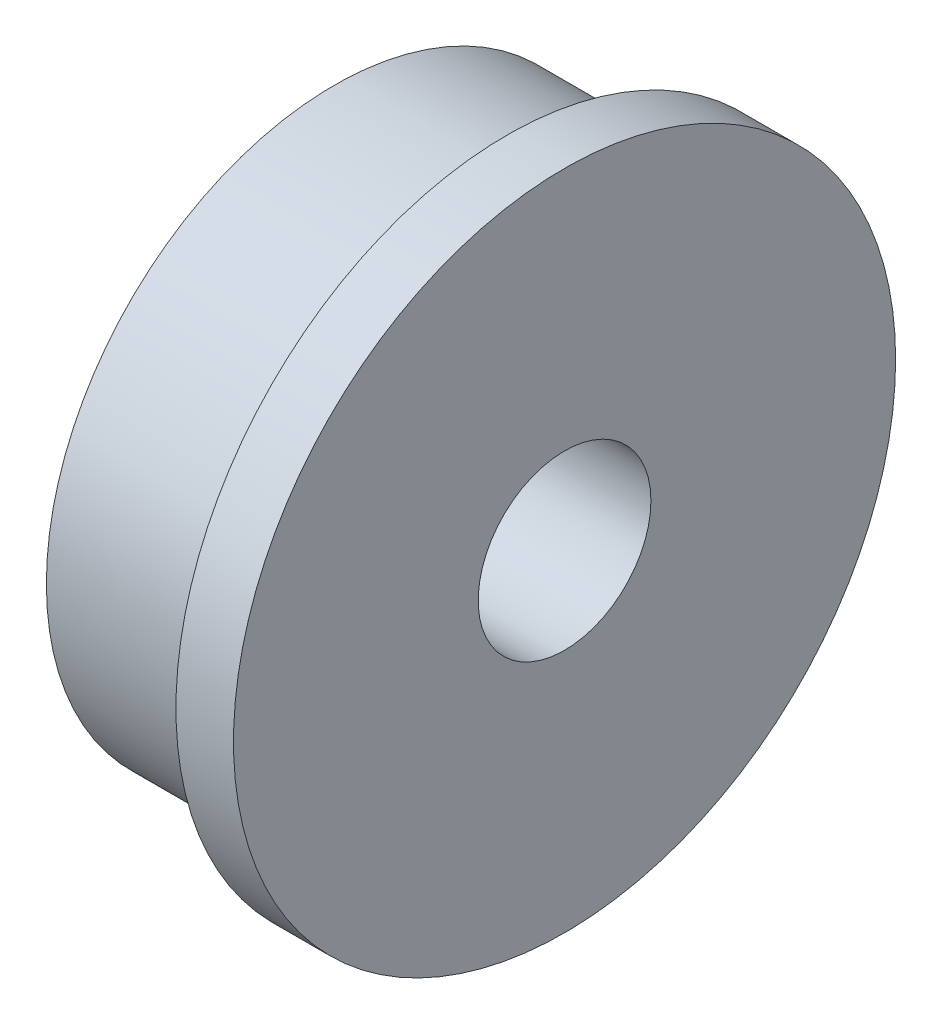
from build123d import *


with BuildPart() as part:
    # 草图2 → 旋转1 (revolve)
    with BuildSketch(Plane.XY, mode=Mode.PRIVATE) as revolve_1_sk:
        Polygon((-5.14352888, 1.5), (-9.14352888, 1.5), (-9.14352888, 5), (-6.14352888, 5), (-6.14352888, 5.75), (-5.14352888, 5.75), align=None)
    revolve(revolve_1_sk.sketch.rotate(Axis((0, 0, 0), (-1, 0, 0)), 90), axis=Axis((0, 0, 0), (-1, 0, 0)))


solid = part.part
